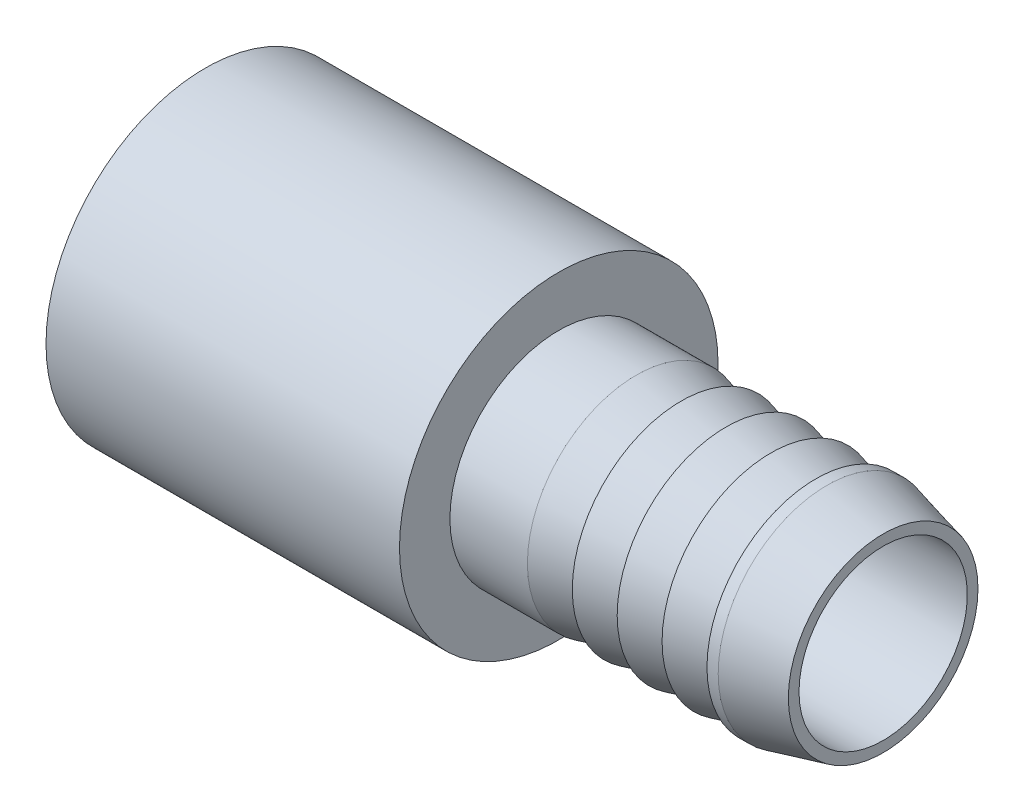
from build123d import *

# Parameters (mm, degrees)
CHAMFER1_SIZE  = 0.79375
CHAMFER1_SIZE2 = 3.175


with BuildPart() as part:
    # Esquisse1 → Revolution1 (revolve)
    with BuildSketch(Plane.XY, mode=Mode.PRIVATE) as revolution1_sk:
        Polygon((-19.304, 5.08), (19.05, 5.08), (19.05, 6.477), (15.24, 6.477), (15.24, 5.842), (12.7, 6.477), (12.7, 5.842), (10.16, 6.477), (10.16, 5.842), (7.62, 6.477), (7.62, 5.842), (5.08, 6.477), (0.696, 6.477), (0.696, 9.33), (-19.304, 9.33), align=None)
    revolve(revolution1_sk.sketch.rotate(Axis((0, 0.3175, 0), (1, 0, 0)), 90), axis=Axis((0, 0.3175, 0), (1, 0, 0)))

    # Chamfer1
    chamfer1_edges = [part.edges().sort_by_distance(p)[0] for p in [
        (19.05, 0.3175, -6.1595),
    ]]
    chamfer1_side = [part.faces().sort_by_distance(p)[0] for p in [
        (19.05, 0.3175, -4.936716969),
    ]]
    chamfer(chamfer1_edges, length=CHAMFER1_SIZE, length2=CHAMFER1_SIZE2, reference=chamfer1_side[0])


solid = part.part
